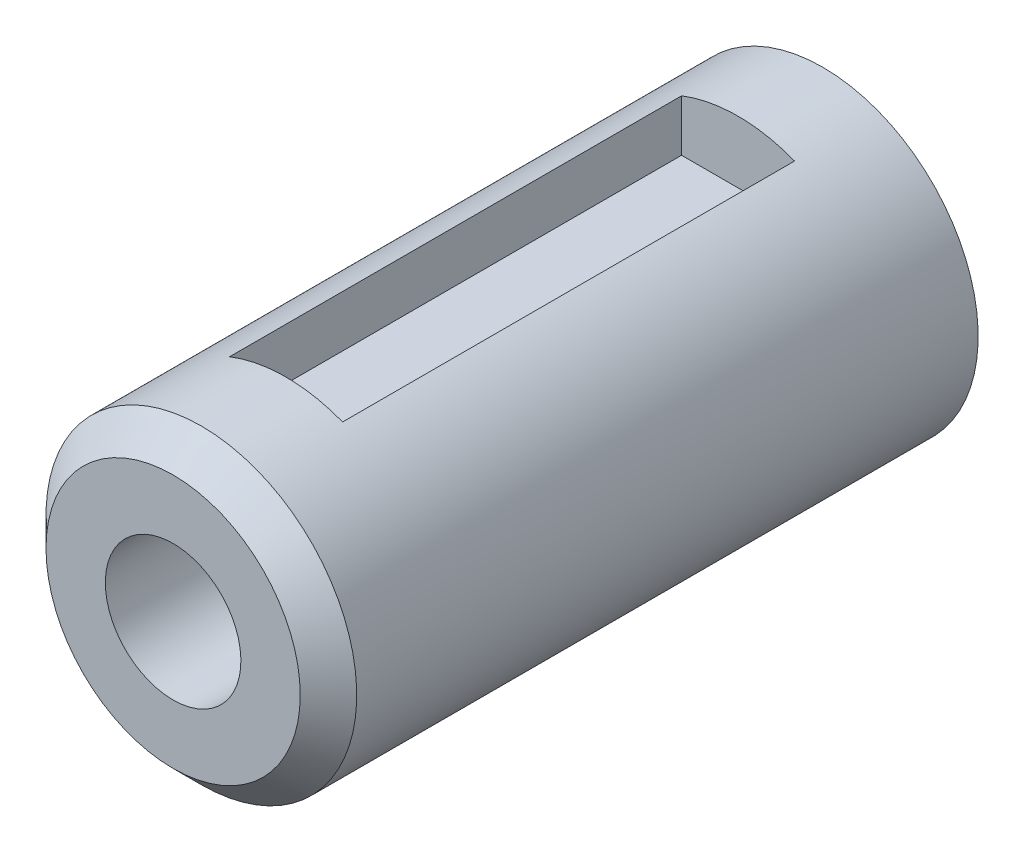
from build123d import *

# Parameters (mm, degrees)
HOLE_WIZARD_M41_D     = 4.8
HOLE_WIZARD_M41_DEPTH = 16
HOLE_WIZARD_M41_TIP   = 1.442065486
CUT_EXTRUDE_1_DEPTH   = 2.2


with BuildPart() as part:
    # Эскиз1 → Повернуть1 (revolve)
    with BuildSketch(Plane(origin=(0, 0, 0), x_dir=(0, 0, -1), z_dir=(1, 0, 0))):
        Polygon((0, 0), (-23, 0), (-23, -4.5), (-22, -5.5), (0, -5.5), align=None)
    revolve(axis=Axis((0, 0, 28.650369954), (0, 0, -1)))

    # Отверстие с зазором M41
    with Locations(Plane(origin=(0, 0, 23), x_dir=(0, 1, 0), z_dir=(0, 0, 1))):
        with Locations((0, 0)):
            Hole(HOLE_WIZARD_M41_D / 2, depth=HOLE_WIZARD_M41_DEPTH)
            with Locations((0, 0, -(HOLE_WIZARD_M41_DEPTH + HOLE_WIZARD_M41_TIP / 2))):  # 118° drill point
                Cone(0, HOLE_WIZARD_M41_D / 2, HOLE_WIZARD_M41_TIP, mode=Mode.SUBTRACT)

    # Эскиз4 → Вырез-Вытянуть1 (cut)
    with BuildSketch(Plane(origin=(0, 5.5, 0), x_dir=(1, 0, 0), z_dir=(0, 1, 0))):
        Polygon((0, -19), (2, -19), (2, -3), (-2, -3), (-2, -19), align=None)
    extrude(amount=-CUT_EXTRUDE_1_DEPTH, mode=Mode.SUBTRACT)


solid = part.part
